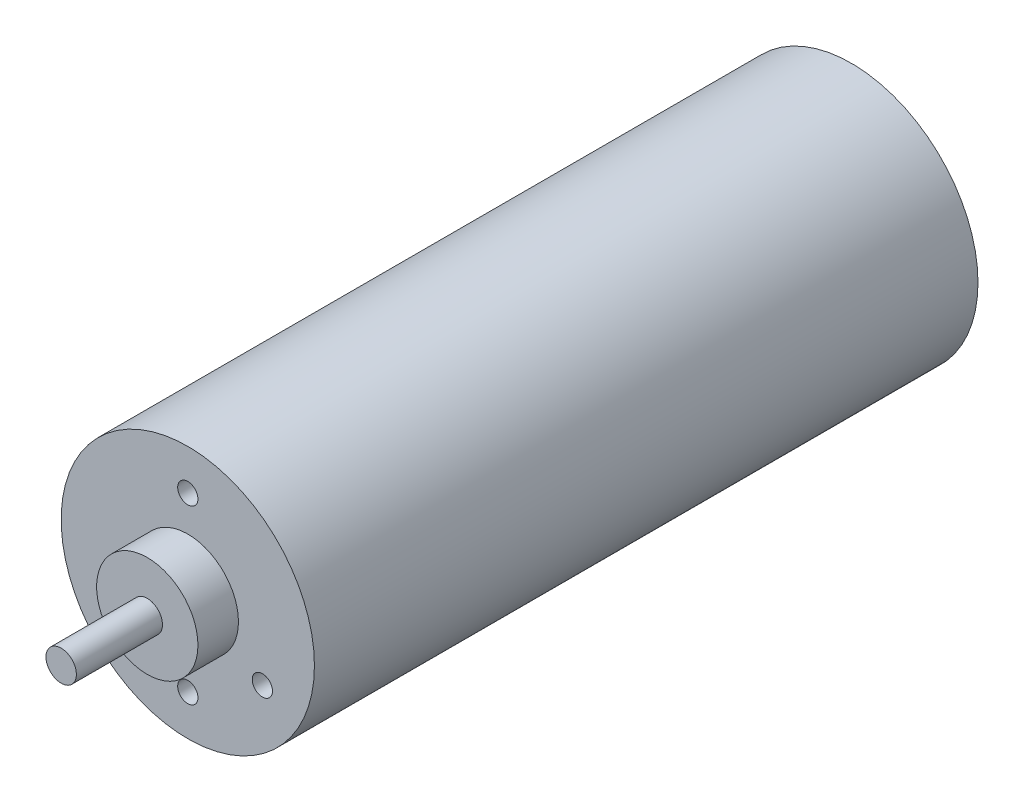
from build123d import *

# Parameters (mm, degrees)
SKETCH_1_R          = 12.5
EXTRUDE_1_DEPTH     = 65.5
SKETCH_2_R          = 5
EXTRUDE_2_DEPTH     = 4
SKETCH_3_R          = 1.5
EXTRUDE_3_DEPTH     = 12.5
SKETCH_4_R          = 1
CUT_EXTRUDE_1_DEPTH = 10


with BuildPart() as part:
    # 스케치1 → 돌출1 (new body)
    with BuildSketch(Plane.XY):
        Circle(SKETCH_1_R)
    extrude(amount=EXTRUDE_1_DEPTH)

    # 스케치2 → 돌출2 (add)
    with BuildSketch(Plane.XY.offset(65.5)):
        Circle(SKETCH_2_R)
    extrude(amount=EXTRUDE_2_DEPTH)

    # 스케치3 → 돌출3 (add)
    with BuildSketch(Plane.XY.offset(65.5)):
        Circle(SKETCH_3_R)
    extrude(amount=EXTRUDE_3_DEPTH)

    # 스케치4 → 컷-돌출1 (cut)
    with BuildSketch(Plane.XY.offset(65.5)):
        with Locations((0, 8.5)):
            Circle(SKETCH_4_R)
        with Locations((0, -8.5)):
            Circle(SKETCH_4_R)
        with Locations((-7.361215932, -4.25)):
            Circle(SKETCH_4_R)
        with Locations((7.361215932, -4.25)):
            Circle(SKETCH_4_R)
    extrude(amount=-CUT_EXTRUDE_1_DEPTH, mode=Mode.SUBTRACT)


solid = part.part
